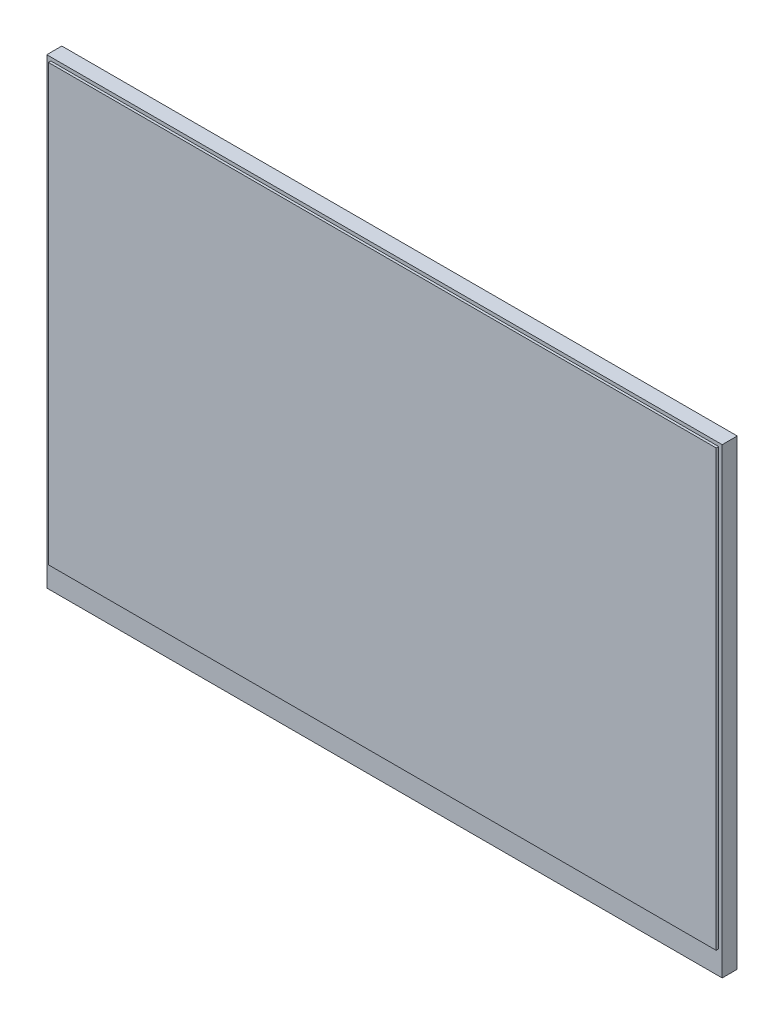
from build123d import *

# Parameters (mm, degrees)
CADREINTERNE_W     = 62.073460636
CADREINTERNE_H     = 40.448352725
BOSS_EXTRU_1_DEPTH = 0.23
CADRE2_W           = 62.792386967
CADRE2_H           = 41.279110161
BOSS_EXTRU_2_DEPTH = 0.6
CADREMAX_W         = 62.792386967
CADREMAX_H         = 42.940137113
BOSS_EXTRU_3_DEPTH = 1.4


with BuildPart() as part:
    # cadreinterne → Boss.-Extru.1 (new body)
    with BuildSketch(Plane.XY):
        with Locations((383.87151409, 1165.56084344)):
            Rectangle(CADREINTERNE_W, CADREINTERNE_H)
    extrude(amount=BOSS_EXTRU_1_DEPTH)

    # cadre2 → Boss.-Extru.2 (add)
    with BuildSketch(Plane.XY):
        with Locations((383.844701739, 1165.459766272)):
            Rectangle(CADRE2_W, CADRE2_H)
    extrude(amount=-BOSS_EXTRU_2_DEPTH)

    # cadremax → Boss.-Extru.3 (add)
    with BuildSketch(Plane.XY):
        with Locations((383.844701739, 1164.629252796)):
            Rectangle(CADREMAX_W, CADREMAX_H)
    extrude(amount=-BOSS_EXTRU_3_DEPTH)


solid = part.part
